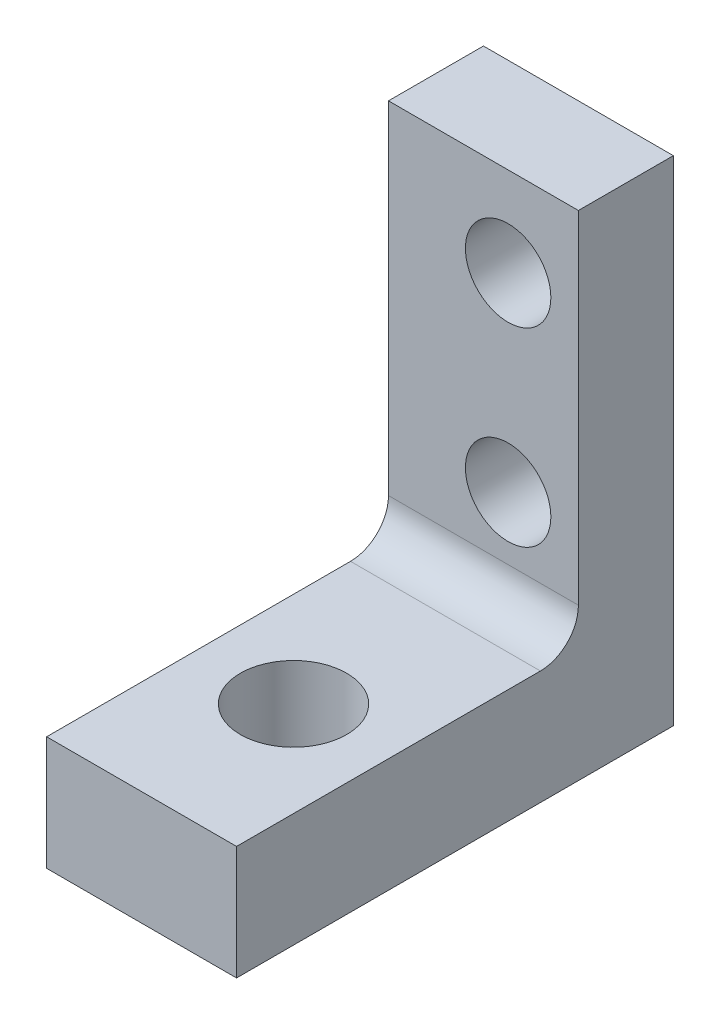
from build123d import *

# Parameters (mm, degrees)
SKETCH1_W           = 10
SKETCH1_H           = 23
SKETCH1_R           = 2.8
BOSS_EXTRUDE1_DEPTH = 6
SKETCH2_W           = 10
SKETCH2_H           = 5
BOSS_EXTRUDE2_DEPTH = 20
SKETCH4_R           = 2.25
CUT_EXTRUDE1_DEPTH  = 10
FILLET1_R           = 2


with BuildPart() as part:
    # Sketch1 → Boss-Extrude1 (new body)
    with BuildSketch(Plane(origin=(0, 0, 0), x_dir=(1, 0, 0), z_dir=(0, 1, 0))):
        with Locations((0, 3.5)):
            Rectangle(SKETCH1_W, SKETCH1_H)
        with Locations(Location((0, 0, 0), (0, 0, 270))):
            Circle(SKETCH1_R, mode=Mode.SUBTRACT)
    extrude(amount=BOSS_EXTRUDE1_DEPTH)

    # Sketch2 → Boss-Extrude2 (add)
    with BuildSketch(Plane(origin=(0, 6, 0), x_dir=(1, 0, 0), z_dir=(0, 1, 0))):
        with Locations((0, 12.5)):
            Rectangle(SKETCH2_W, SKETCH2_H)
    extrude(amount=BOSS_EXTRUDE2_DEPTH)

    # Sketch4 → Cut-Extrude1 (cut)
    with BuildSketch(Plane.XY.offset(-10)):
        with Locations((1.3, 11.3)):
            Circle(SKETCH4_R)
        with Locations((1.3, 21.3)):
            Circle(SKETCH4_R)
    extrude(amount=-CUT_EXTRUDE1_DEPTH, mode=Mode.SUBTRACT)

    # Fillet1
    fillet1_edges = [part.edges().sort_by_distance(p)[0] for p in [
        (0, 6, -10),
    ]]
    fillet(fillet1_edges, radius=FILLET1_R)


solid = part.part
